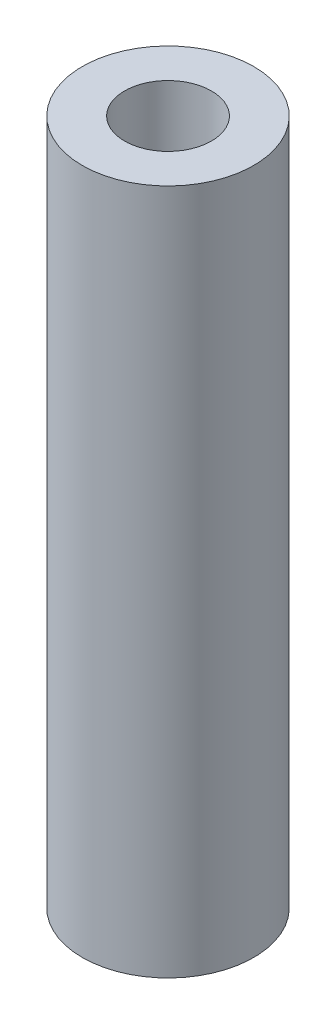
from build123d import *

# Parameters (mm, degrees)
SKETCH1_R           = 4.7625
SKETCH1_R_2         = 2.413
BOSS_EXTRUDE1_DEPTH = 38.1


with BuildPart() as part:
    # Sketch1 → Boss-Extrude1 (new body)
    with BuildSketch(Plane(origin=(0, 0, 0), x_dir=(1, 0, 0), z_dir=(0, 1, 0))):
        with Locations(Location((0, 0, 0), (0, 0, 90))):
            Circle(SKETCH1_R)
        with Locations(Location((0, 0, 0), (0, 0, 90))):
            Circle(SKETCH1_R_2, mode=Mode.SUBTRACT)
    extrude(amount=BOSS_EXTRUDE1_DEPTH)


solid = part.part
